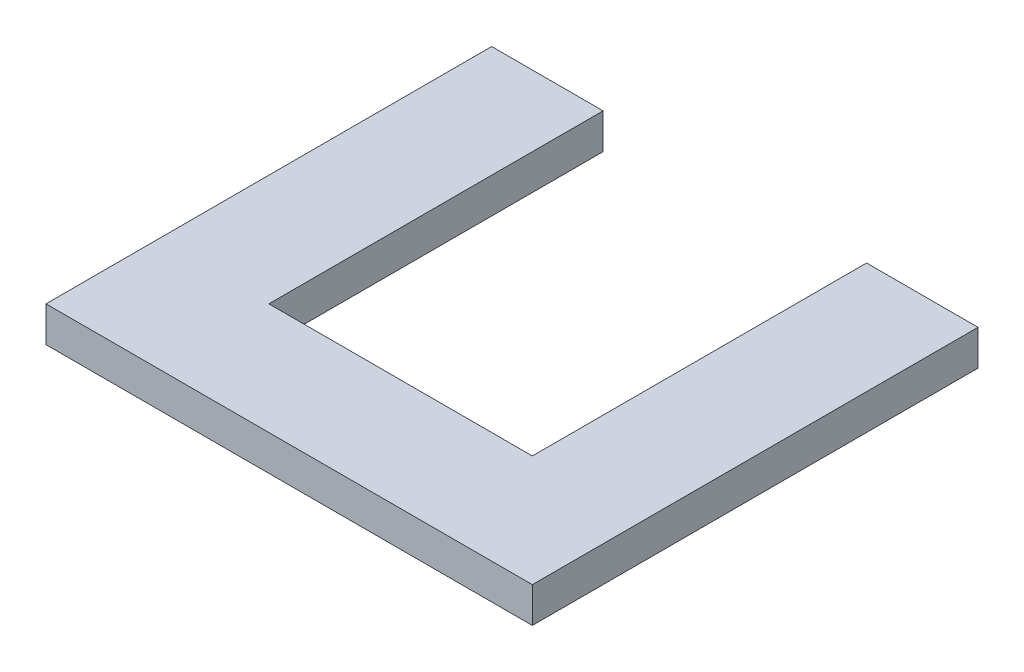
from build123d import *

# Parameters (mm, degrees)
BOSS_EXTRUDE1_DEPTH = 6.35


with BuildPart() as part:
    # Sketch1 → Boss-Extrude1 (new body)
    with BuildSketch(Plane(origin=(0, 0, 0), x_dir=(1, 0, 0), z_dir=(0, 1, 0))):
        Polygon((0, 80), (0, 0), (87.3, 0), (87.3, 80), (67.3, 80), (67.3, 20), (20, 20), (20, 80), align=None)
    extrude(amount=BOSS_EXTRUDE1_DEPTH)


solid = part.part
